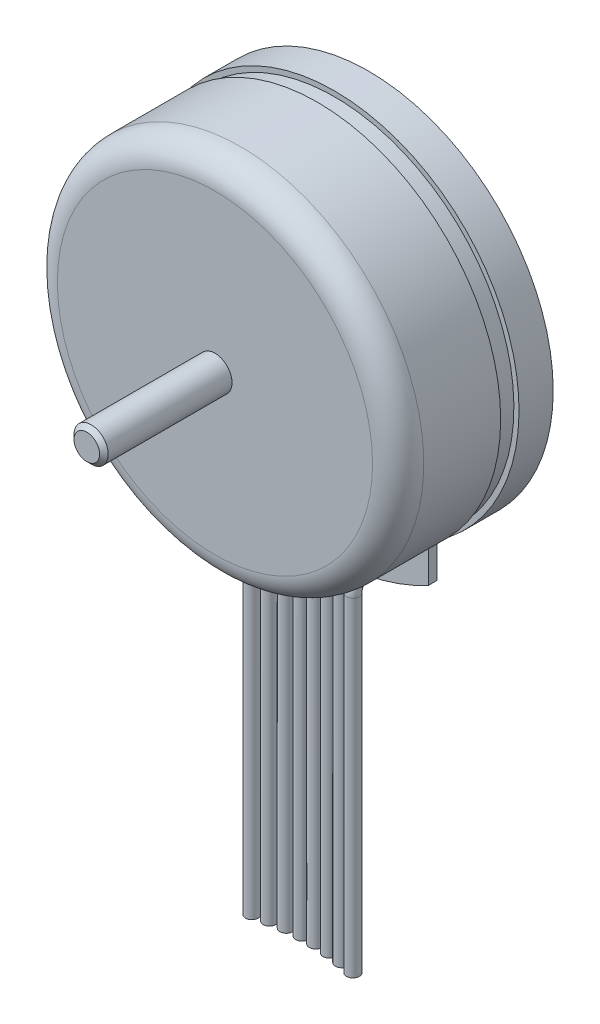
from build123d import *

# Parameters (mm, degrees)
SKETCH_1_R               = 21.6
EXTRUDE_1_DEPTH          = 4
SKETCH_6_R               = 21.45
EXTRUDE_6_DEPTH          = 18
SKETCH_2_R               = 2
EXTRUDE_2_DEPTH          = 15
SKETCH_3_R               = 1.25
CUT_EXTRUDE_3_DEPTH      = 3.9
PATTERN_CIRCULAR_1_COUNT = 3
SKETCH_4_R               = 8
EXTRUDE_4_DEPTH          = 3.2
EXTRUDE_START            = 7.8
SKETCH_5_R               = 2
EXTRUDE_5_DEPTH          = 7.8
SKETCH_7_R               = 21.45
SKETCH_7_R_2             = 21
CUT_EXTRUDE_7_DEPTH      = 2
EXTRUDE_9_DEPTH          = 1
CHAMFER_1_SIZE           = 0.5
FILLET_1_R               = 3
SKETCH_10_OUTSIDE_W      = 62.704
SKETCH_10_OUTSIDE_H      = 81.606
SKETCH_10_OUTSIDE_R      = 25.1
CUT_EXTRUDE_1_DEPTH      = 10
SKETCH_11_R              = 0.75


with BuildPart() as part:
    # 草图1 → 拉伸1 (new body)
    with BuildSketch(Plane.XY):
        Circle(SKETCH_1_R)
    extrude(amount=EXTRUDE_1_DEPTH)

    # 草图6 → 拉伸6 (add)
    with BuildSketch(Plane(origin=(0, 0, 0), x_dir=(-1, 0, 0), z_dir=(0, 0, -1))):
        Circle(SKETCH_6_R)
    extrude(amount=-EXTRUDE_6_DEPTH)

    # 草图2 → 拉伸2 (add)
    with BuildSketch(Plane.XY.offset(18)):
        with Locations(Location((0, 0, 0), (0, 0, 180))):
            Circle(SKETCH_2_R)
    extrude(amount=EXTRUDE_2_DEPTH)

    # 草图3 → 拉伸3 (cut)
    with BuildSketch(Plane(origin=(0, 0, 0), x_dir=(-1, 0, 0), z_dir=(0, 0, -1))):
        with Locations((0, 11)):
            Circle(SKETCH_3_R)
    cut_extrude_3 = extrude(amount=-CUT_EXTRUDE_3_DEPTH, mode=Mode.SUBTRACT)

    # 阵列(圆周)1: 拉伸3 ×3 about axis
    pattern_circular_1_axis = Axis((0, 0, 0), (0, 0, 1))
    for i in range(1, PATTERN_CIRCULAR_1_COUNT):
        add(cut_extrude_3.rotate(pattern_circular_1_axis, i * 360 / PATTERN_CIRCULAR_1_COUNT), mode=Mode.SUBTRACT)

    # 草图4 → 拉伸4 (add)
    with BuildSketch(Plane(origin=(0, 0, 0), x_dir=(-1, 0, 0), z_dir=(0, 0, -1))):
        with Locations(Location((0, 0, 0), (0, 0, 180))):
            Circle(SKETCH_4_R)
    extrude(amount=EXTRUDE_4_DEPTH)

    # 草图5 → 拉伸5 (add)
    with BuildSketch(Plane(origin=(0, 0, -3.2), x_dir=(-1, 0, 0), z_dir=(0, 0, -1)).offset(EXTRUDE_START)):
        Circle(SKETCH_5_R)
    extrude(amount=-EXTRUDE_5_DEPTH)

    # 草图7 → 拉伸7 (cut)
    with BuildSketch(Plane.XY.offset(4)):
        with Locations(Location((0, 0, 0), (0, 0, 180))):
            Circle(SKETCH_7_R)
        Circle(SKETCH_7_R_2, mode=Mode.SUBTRACT)
    extrude(amount=CUT_EXTRUDE_7_DEPTH, mode=Mode.SUBTRACT)

    # 草图9 → 拉伸9 (add)
    with BuildSketch(Plane.XY.offset(4)):
        Polygon((-12, -17.23368794), (12, -17.23368794), (12, -38.502475842), (14, -40.502475842), (-10, -40.502475842), (-12, -38.502475842), align=None)
    extrude(amount=EXTRUDE_9_DEPTH)

    # 倒角1
    chamfer_1_edges = [part.edges().sort_by_distance(p)[0] for p in [
        (2, 0, 33),
        (2, 0, -11),
    ]]
    chamfer(chamfer_1_edges, length=CHAMFER_1_SIZE)

    # 圆角1
    fillet_1_edges = [part.edges().sort_by_distance(p)[0] for p in [
        (21.45, 0, 18),
    ]]
    fillet(fillet_1_edges, radius=FILLET_1_R)

    # 草图10 outside → 切除-拉伸1 (cut)
    with BuildSketch(Plane(origin=(0, 0, 0), x_dir=(-1, 0, 0), z_dir=(0, 0, -1))):
        with Locations((0, -9.451)):
            Rectangle(SKETCH_10_OUTSIDE_W, SKETCH_10_OUTSIDE_H)
        Circle(SKETCH_10_OUTSIDE_R, mode=Mode.SUBTRACT)
    extrude(amount=-CUT_EXTRUDE_1_DEPTH, mode=Mode.SUBTRACT)

    # 扫描1: sweep along a path in 草图12
    with BuildLine(Plane(origin=(0, 0, 0), x_dir=(0, 0, -1), z_dir=(1, 0, 0))) as sweep_1_path:
        Line((-5, -22.985989021), (-5.5, -22.985989021))
        ThreePointArc((-5.5, -22.985989021), (-6.560660172, -23.42532885), (-7, -24.485989021))
        Line((-7, -24.485989021), (-7, -62.985989021))
    # 草图11 → 扫描1 (sweep)
    with BuildSketch(Plane.XY.offset(5)):
        with Locations((-0.802688424, -22.985989021)):
            Circle(SKETCH_11_R)
        with Locations((-2.522346506, -22.861272233)):
            Circle(SKETCH_11_R)
        with Locations((-4.227829963, -22.608083815)):
            Circle(SKETCH_11_R)
        with Locations((-5.909554629, -22.227846591)):
            Circle(SKETCH_11_R)
        with Locations((5.909554629, -22.227846591)):
            Circle(SKETCH_11_R)
        with Locations((4.227829963, -22.608083815)):
            Circle(SKETCH_11_R)
        with Locations((2.522346506, -22.861272233)):
            Circle(SKETCH_11_R)
        with Locations((0.802688424, -22.985989021)):
            Circle(SKETCH_11_R)
    sweep(path=sweep_1_path.line)


solid = part.part
